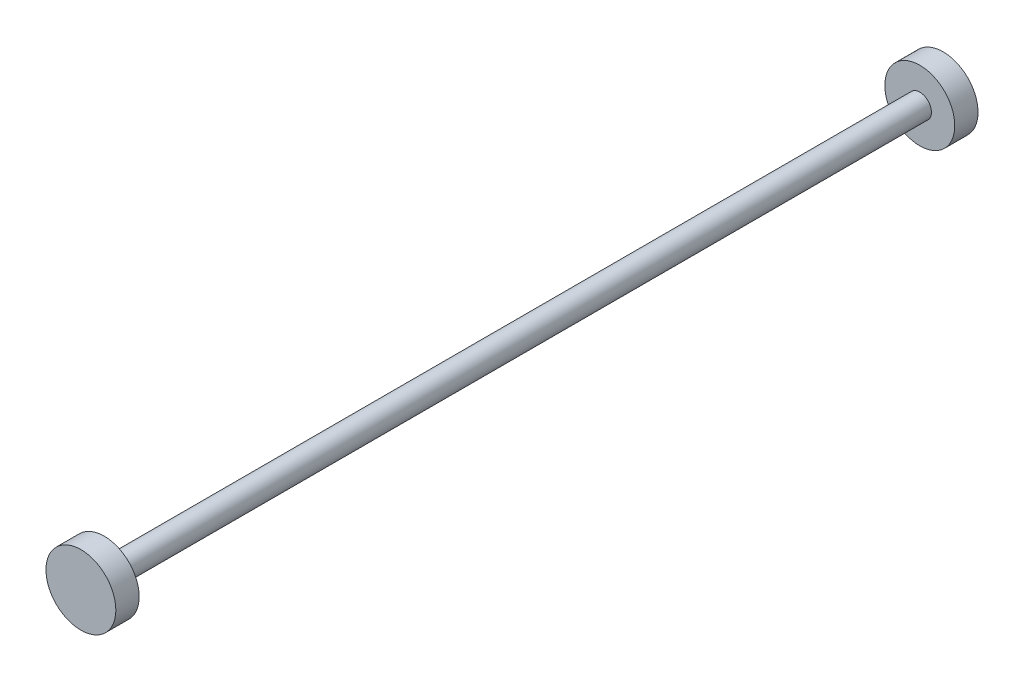
from build123d import *

# Parameters (mm, degrees)
SKETCH1_R           = 12.7
BOSS_EXTRUDE2_DEPTH = 889
SKETCH4_R           = 38.1
BOSS_EXTRUDE4_DEPTH = 25.4
BOSS_EXTRUDE5_START = 25.4
SKETCH5_R           = 38.1
BOSS_EXTRUDE5_DEPTH = 25.4


with BuildPart() as part:
    # Sketch1 → Boss-Extrude2 (new body)
    with BuildSketch(Plane.XY):
        with Locations((-12.210402701, 19.442718147)):
            Circle(SKETCH1_R)
    extrude(amount=BOSS_EXTRUDE2_DEPTH)

    # Sketch4 → Boss-Extrude4 (add)
    with BuildSketch(Plane.XY.offset(889)):
        with Locations((-12.210402701, 19.442718147)):
            Circle(SKETCH4_R)
    extrude(amount=BOSS_EXTRUDE4_DEPTH)

    # Sketch5 → Boss-Extrude5 (add)
    with BuildSketch(Plane(origin=(0, 0, 0), x_dir=(-1, 0, 0), z_dir=(0, 0, -1)).offset(BOSS_EXTRUDE5_START)):
        with Locations(Location((12.210402701, 19.442718147, 0), (0, 0, 180))):
            Circle(SKETCH5_R)
    extrude(amount=-BOSS_EXTRUDE5_DEPTH)


solid = part.part
